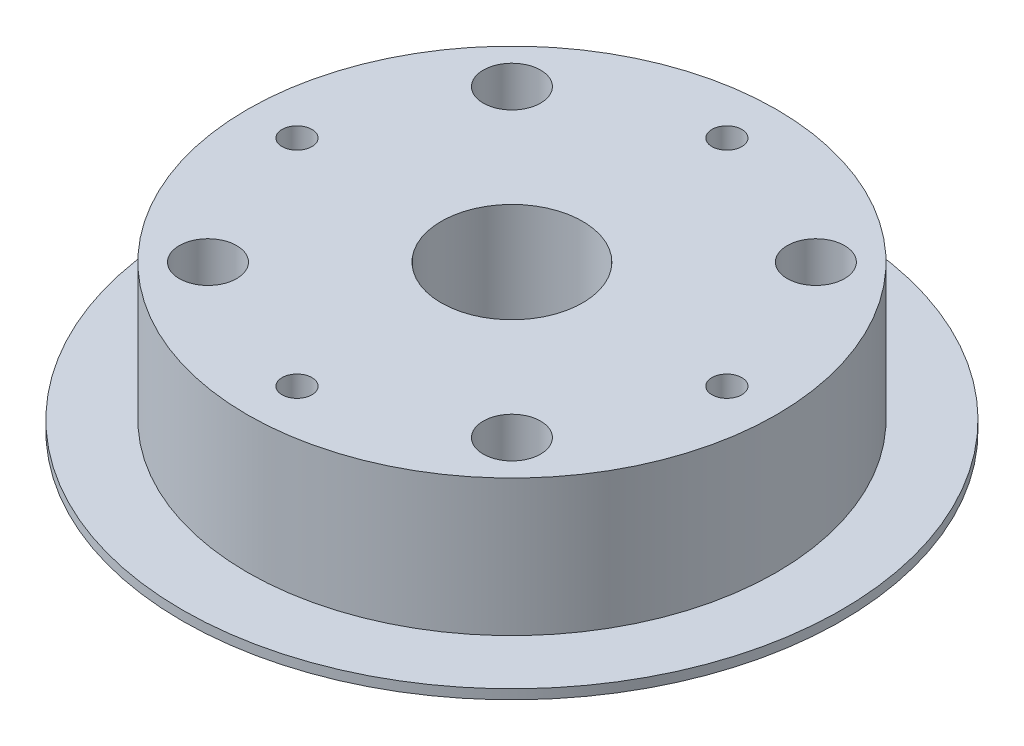
from build123d import *

# Parameters (mm, degrees)
SKETCH1_R           = 34.5
SKETCH1_R_2         = 1.5635
SKETCH1_R_3         = 7.4
BOSS_EXTRUDE1_DEPTH = 1
BOSS_EXTRUDE2_START = 14.2875
SKETCH1_3_R         = 27.69
SKETCH1_3_R_2       = 7.4
SKETCH1_3_R_3       = 1.5635
BOSS_EXTRUDE2_DEPTH = 14.2875
SKETCH2_R           = 3
SKETCH2_R_2         = 1.5635
CUT_EXTRUDE1_DEPTH  = 4.7625
CUT_EXTRUDE4_START  = -1
CUT_EXTRUDE4_DEPTH  = 4.7625


with BuildPart() as part:
    # Sketch1 → Boss-Extrude1 (new body)
    with BuildSketch(Plane(origin=(0, 0, 0), x_dir=(1, 0, 0), z_dir=(0, 1, 0))):
        Circle(SKETCH1_R)
        with Locations((22.5, 0)):
            Circle(SKETCH1_R_2, mode=Mode.SUBTRACT)
        with Locations((-15.909902577, -15.909902577)):
            Circle(SKETCH1_R_2, mode=Mode.SUBTRACT)
        with Locations((0, -22.5)):
            Circle(SKETCH1_R_2, mode=Mode.SUBTRACT)
        with Locations((15.909902577, -15.909902577)):
            Circle(SKETCH1_R_2, mode=Mode.SUBTRACT)
        with Locations((-22.5, 0)):
            Circle(SKETCH1_R_2, mode=Mode.SUBTRACT)
        with Locations((-15.909902577, 15.909902577)):
            Circle(SKETCH1_R_2, mode=Mode.SUBTRACT)
        with Locations((0, 22.5)):
            Circle(SKETCH1_R_2, mode=Mode.SUBTRACT)
        with Locations((15.909902577, 15.909902577)):
            Circle(SKETCH1_R_2, mode=Mode.SUBTRACT)
        Circle(SKETCH1_R_3, mode=Mode.SUBTRACT)
    extrude(amount=-BOSS_EXTRUDE1_DEPTH)

    # Sketch1<3> → Boss-Extrude2 (add)
    with BuildSketch(Plane(origin=(0, 0, 0), x_dir=(1, 0, 0), z_dir=(0, 1, 0)).offset(BOSS_EXTRUDE2_START)):
        Circle(SKETCH1_3_R)
        Circle(SKETCH1_3_R_2, mode=Mode.SUBTRACT)
        with Locations((-15.909902577, -15.909902577)):
            Circle(SKETCH1_3_R_3, mode=Mode.SUBTRACT)
        with Locations((0, -22.5)):
            Circle(SKETCH1_3_R_3, mode=Mode.SUBTRACT)
        with Locations((15.909902577, -15.909902577)):
            Circle(SKETCH1_3_R_3, mode=Mode.SUBTRACT)
        with Locations((-22.5, 0)):
            Circle(SKETCH1_3_R_3, mode=Mode.SUBTRACT)
        with Locations((-15.909902577, 15.909902577)):
            Circle(SKETCH1_3_R_3, mode=Mode.SUBTRACT)
        with Locations((0, 22.5)):
            Circle(SKETCH1_3_R_3, mode=Mode.SUBTRACT)
        with Locations((22.5, 0)):
            Circle(SKETCH1_3_R_3, mode=Mode.SUBTRACT)
        with Locations((15.909902577, 15.909902577)):
            Circle(SKETCH1_3_R_3, mode=Mode.SUBTRACT)
    extrude(amount=-BOSS_EXTRUDE2_DEPTH)

    # Sketch2 → Cut-Extrude1 (cut)
    # profile 1 of 4: a face of its own
    with BuildSketch(Plane(origin=(0, 14.2875, 0), x_dir=(1, 0, 0), z_dir=(0, 1, 0))):
        with Locations((15.909902577, 15.909902577)):
            Circle(SKETCH2_R)
        with Locations((15.909902577, 15.909902577)):
            Circle(SKETCH2_R_2, mode=Mode.SUBTRACT)
    # profile 2 of 4: a face of its own
    with BuildSketch(Plane(origin=(0, 14.2875, 0), x_dir=(1, 0, 0), z_dir=(0, 1, 0))):
        with Locations((15.909902577, -15.909902577)):
            Circle(SKETCH2_R)
    # profile 3 of 4: a face of its own
    with BuildSketch(Plane(origin=(0, 14.2875, 0), x_dir=(1, 0, 0), z_dir=(0, 1, 0))):
        with Locations((-15.909902577, -15.909902577)):
            Circle(SKETCH2_R)
        with Locations((-15.909902577, -15.909902577)):
            Circle(SKETCH2_R_2, mode=Mode.SUBTRACT)
    # profile 4 of 4: a face of its own
    with BuildSketch(Plane(origin=(0, 14.2875, 0), x_dir=(1, 0, 0), z_dir=(0, 1, 0))):
        with Locations((-15.909902577, 15.909902577)):
            Circle(SKETCH2_R)
        with Locations((-15.909902577, 15.909902577)):
            Circle(SKETCH2_R_2, mode=Mode.SUBTRACT)
    extrude(amount=-CUT_EXTRUDE1_DEPTH, mode=Mode.SUBTRACT)

    # Sketch4 → Cut-Extrude4 (cut)
    with BuildSketch(Plane.XZ.offset(1).offset(CUT_EXTRUDE4_START)):
        Polygon((22.5, 3.117691454), (19.8, 1.558845727), (19.8, -1.558845727), (22.5, -3.117691454), (25.2, -1.558845727), (25.2, 1.558845727), align=None)
        Polygon((1.558845727, 25.2), (-1.558845727, 25.2), (-3.117691454, 22.5), (-1.558845727, 19.8), (1.558845727, 19.8), (3.117691454, 22.5), align=None)
        Polygon((3.117691454, -22.5), (1.558845727, -19.8), (-1.558845727, -19.8), (-3.117691454, -22.5), (-1.558845727, -25.2), (1.558845727, -25.2), align=None)
        Polygon((-22.5, -3.117691454), (-19.8, -1.558845727), (-19.8, 1.558845727), (-22.5, 3.117691454), (-25.2, 1.558845727), (-25.2, -1.558845727), align=None)
    extrude(amount=-CUT_EXTRUDE4_DEPTH, mode=Mode.SUBTRACT)


solid = part.part
